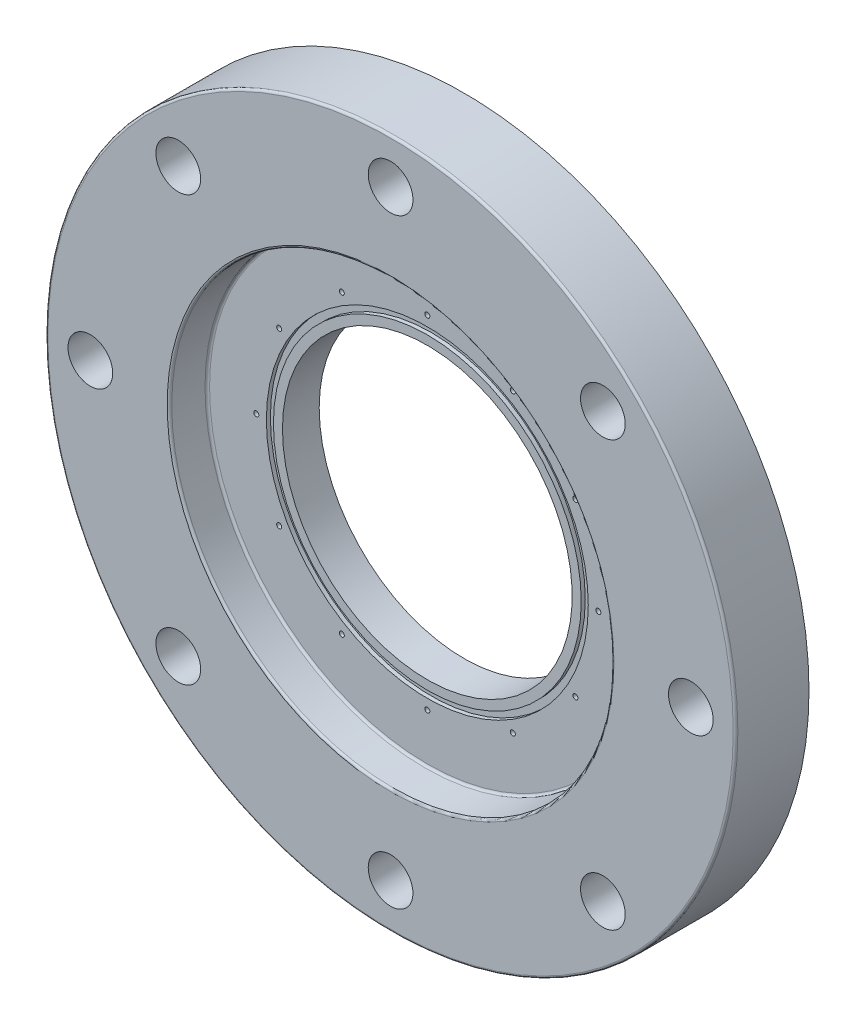
from build123d import *

# Parameters (mm, degrees)
SKETCH1_R          = 171.45
EXTRUDE1_DEPTH     = 36.5125
SKETCH2_R          = 11.1125
EXTRUDE2_DEPTH     = 246.20066814
CIRPATTERN1_COUNT  = 8
FILLET1_R          = 1.154545455
SKETCH4_R          = 72
CUT_EXTRUDE1_DEPTH = 120
CIRPATTERN2_COUNT  = 12
SKETCH5_R          = 80
SKETCH5_R_2        = 76.5
CUT_EXTRUDE2_DEPTH = 2


with BuildPart() as part:
    # Sketch1 → Extrude1 (new body)
    with BuildSketch(Plane.XY):
        Circle(SKETCH1_R)
    extrude(amount=EXTRUDE1_DEPTH)

    # Sketch2 → Extrude2 (cut, through all)
    with BuildSketch(Plane.XY.offset(36.5125)):
        with Locations((0, 149.225)):
            Circle(SKETCH2_R)
    extrude2 = extrude(amount=-EXTRUDE2_DEPTH, mode=Mode.SUBTRACT)

    # CirPattern1: Extrude2 ×8 about axis
    cirpattern1_axis = Axis((0, 0, 0), (0, 0, 1))
    for i in range(1, CIRPATTERN1_COUNT):
        add(extrude2.rotate(cirpattern1_axis, i * 360 / CIRPATTERN1_COUNT), mode=Mode.SUBTRACT)

    # Sketch3 → Cut-Revolve1 (revolve, cut)
    with BuildSketch(Plane(origin=(0, 0, 0), x_dir=(0, 0, -1), z_dir=(1, 0, 0))):
        Polygon((-36.5125, 109.9185), (-18.25625, 109.347), (-18.25625, 0), (-36.5125, 0), align=None)
    revolve(axis=Axis((0, 0, 18.25625), (0, 0, 1)), mode=Mode.SUBTRACT)

    # Fillet1
    fillet1_edges = [part.edges().sort_by_distance(p)[0] for p in [
        (0, -109.347, 18.25625),
        (0, -109.9185, 36.5125),
        (-171.45, 0, 36.5125),
    ]]
    fillet(fillet1_edges, radius=FILLET1_R)

    # Sketch4 → Cut-Extrude1 (cut)
    with BuildSketch(Plane(origin=(0, 0, 0), x_dir=(-1, 0, 0), z_dir=(0, 0, -1))):
        Circle(SKETCH4_R)
    extrude(amount=-CUT_EXTRUDE1_DEPTH, mode=Mode.SUBTRACT)

    # Sketch8 → M3x0.5 Tapped Hole1 (revolve, cut)
    with BuildSketch(Plane(origin=(0, 85, 18.25625), x_dir=(0, -1, 0), z_dir=(1, 0, 0))):
        Polygon((0, 0), (0, 12.751075774), (1.25, 12), (1.25, 0), align=None)
    m3x0_5_tapped_hole1 = revolve(axis=Axis((0, 85, 24.60625), (0, 0, -1)), mode=Mode.SUBTRACT)

    # CirPattern2: M3x0.5 Tapped Hole1 ×12 about axis
    cirpattern2_axis = Axis((0, 0, 0), (0, 0, 1))
    for i in range(1, CIRPATTERN2_COUNT):
        add(m3x0_5_tapped_hole1.rotate(cirpattern2_axis, i * 360 / CIRPATTERN2_COUNT), mode=Mode.SUBTRACT)

    # Sketch5 → Cut-Extrude2 (cut)
    with BuildSketch(Plane(origin=(0, 0, 18.25625), x_dir=(-1, 0, 0), z_dir=(0, 0, -1))):
        Circle(SKETCH5_R)
        Circle(SKETCH5_R_2, mode=Mode.SUBTRACT)
    extrude(amount=CUT_EXTRUDE2_DEPTH, mode=Mode.SUBTRACT)


solid = part.part
